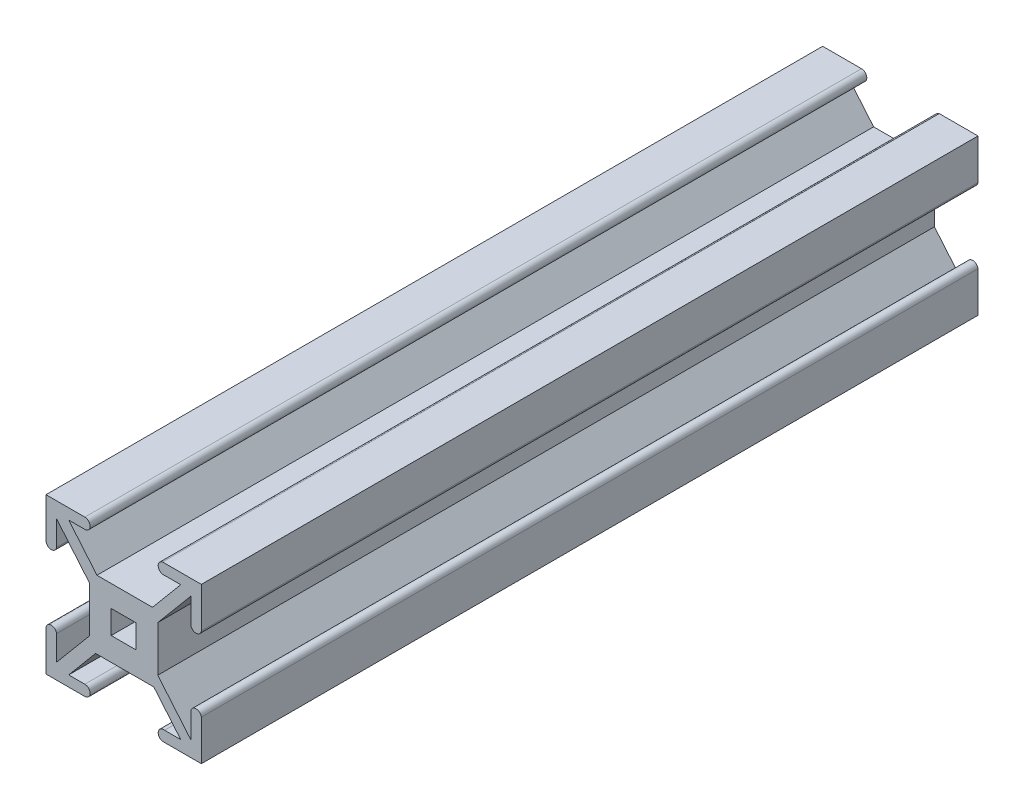
from build123d import *

# Parameters (mm, degrees)
SKETCH1_W           = 50
SKETCH1_H           = 50
BOSS_EXTRUDE1_DEPTH = 250
SKETCH2_W           = 18
SKETCH2_H           = 18
CUT_EXTRUDE2_DEPTH  = 287
SKETCH3_OUTSIDE_W   = 103.962
SKETCH3_OUTSIDE_H   = 103.962
CUT_EXTRUDE5_DEPTH  = 287
SKETCH4_W           = 18
SKETCH4_H           = 18
BOSS_EXTRUDE2_DEPTH = 250
SKETCH5_W           = 8
SKETCH5_H           = 7.553245746
CUT_EXTRUDE6_DEPTH  = 250


with BuildPart() as part:
    # Sketch1 → Boss-Extrude1 (new body)
    with BuildSketch(Plane.XY):
        with Locations((3.9408867, 0)):
            Rectangle(SKETCH1_W, SKETCH1_H)
    extrude(amount=BOSS_EXTRUDE1_DEPTH)

    # Sketch2 → Cut-Extrude2 (cut)
    with BuildSketch(Plane(origin=(0, 0, 0), x_dir=(-1, 0, 0), z_dir=(0, 0, -1))):
        with Locations((-3.9408867, 0)):
            Rectangle(SKETCH2_W, SKETCH2_H)
    extrude(amount=-CUT_EXTRUDE2_DEPTH, mode=Mode.SUBTRACT)

    # Sketch3 outside → Cut-Extrude5 (cut)
    with BuildSketch(Plane(origin=(0, 0, 0), x_dir=(-1, 0, 0), z_dir=(0, 0, -1))):
        with Locations((-3.941, 0)):
            Rectangle(SKETCH3_OUTSIDE_W, SKETCH3_OUTSIDE_H)
        with BuildLine():
            Line((-22.316271067, 21.584230763), (-17.116271067, 21.584230763))
            ThreePointArc((-17.116271067, 21.584230763), (-15.082817857, 22.96654679), (-16.465133883, 25))
            Line((-16.465133883, 25), (-28.9408867, 25))
            Line((-28.9408867, 25), (-28.9408867, 12.5))
            ThreePointArc((-28.9408867, 12.5), (-27.489165976, 10.551720724), (-25.5408867, 12.003441448))
            Line((-25.5408867, 12.003441448), (-25.5408867, 20.003441448))
            Line((-25.5408867, 20.003441448), (-18.539469589, 11.659477453))
            Line((-18.539469589, 11.659477453), (-14.917465737, 7.34294135))
            Line((-14.917465737, 7.34294135), (-14.917465737, -7.34294135))
            Line((-14.917465737, -7.34294135), (-18.539469589, -11.659477453))
            Line((-18.539469589, -11.659477453), (-25.5408867, -20.003441448))
            Line((-25.5408867, -20.003441448), (-25.5408867, -12.003441448))
            ThreePointArc((-25.5408867, -12.003441448), (-27.489165976, -10.551720724), (-28.9408867, -12.5))
            Line((-28.9408867, -12.5), (-28.9408867, -25))
            Line((-28.9408867, -25), (-16.465133883, -25))
            ThreePointArc((-16.465133883, -25), (-15.082817857, -22.96654679), (-17.116271067, -21.584230763))
            Line((-17.116271067, -21.584230763), (-22.316271067, -21.584230763))
            Line((-22.316271067, -21.584230763), (-17.28167328, -15.584230763))
            Line((-17.28167328, -15.584230763), (-13.653142176, -11.259915785))
            Line((-13.653142176, -11.259915785), (5.089795616, -11.259915785))
            Line((5.089795616, -11.259915785), (8.71832672, -15.584230763))
            Line((8.71832672, -15.584230763), (13.752924507, -21.584230763))
            Line((13.752924507, -21.584230763), (8.5591133, -21.584230763))
            ThreePointArc((8.5591133, -21.584230763), (6.851228682, -23.292115382), (8.5591133, -25))
            Line((8.5591133, -25), (21.0591133, -25))
            Line((21.0591133, -25), (21.0591133, -12.5))
            ThreePointArc((21.0591133, -12.5), (19.607392577, -10.551720724), (17.6591133, -12.003441448))
            Line((17.6591133, -12.003441448), (17.6591133, -20.003441448))
            Line((17.6591133, -20.003441448), (10.65769619, -11.659477453))
            Line((10.65769619, -11.659477453), (7.035692338, -7.34294135))
            Line((7.035692338, -7.34294135), (7.035692338, 7.34294135))
            Line((7.035692338, 7.34294135), (10.65769619, 11.659477453))
            Line((10.65769619, 11.659477453), (17.6591133, 20.003441448))
            Line((17.6591133, 20.003441448), (17.6591133, 12.003441448))
            ThreePointArc((17.6591133, 12.003441448), (19.607392577, 10.551720724), (21.0591133, 12.5))
            Line((21.0591133, 12.5), (21.0591133, 25))
            Line((21.0591133, 25), (8.5591133, 25))
            ThreePointArc((8.5591133, 25), (6.851228682, 23.292115382), (8.5591133, 21.584230763))
            Line((8.5591133, 21.584230763), (13.752924507, 21.584230763))
            Line((13.752924507, 21.584230763), (8.71832672, 15.584230763))
            Line((8.71832672, 15.584230763), (4.653605138, 10.740084215))
            Line((4.653605138, 10.740084215), (-13.216951698, 10.740084215))
            Line((-13.216951698, 10.740084215), (-17.28167328, 15.584230763))
            Line((-17.28167328, 15.584230763), (-22.316271067, 21.584230763))
        make_face(mode=Mode.SUBTRACT)
    extrude(amount=-CUT_EXTRUDE5_DEPTH, mode=Mode.SUBTRACT)

    # Sketch4 → Boss-Extrude2 (add)
    with BuildSketch(Plane(origin=(0, 0, 0), x_dir=(-1, 0, 0), z_dir=(0, 0, -1))):
        with Locations((-3.9408867, 0)):
            Rectangle(SKETCH4_W, SKETCH4_H)
    extrude(amount=-BOSS_EXTRUDE2_DEPTH)

    # Sketch5 → Cut-Extrude6 (cut)
    with BuildSketch(Plane(origin=(0, 0, 0), x_dir=(-1, 0, 0), z_dir=(0, 0, -1))):
        with Locations((-3.917465737, 0)):
            Rectangle(SKETCH5_W, SKETCH5_H)
    extrude(amount=-CUT_EXTRUDE6_DEPTH, mode=Mode.SUBTRACT)


solid = part.part
